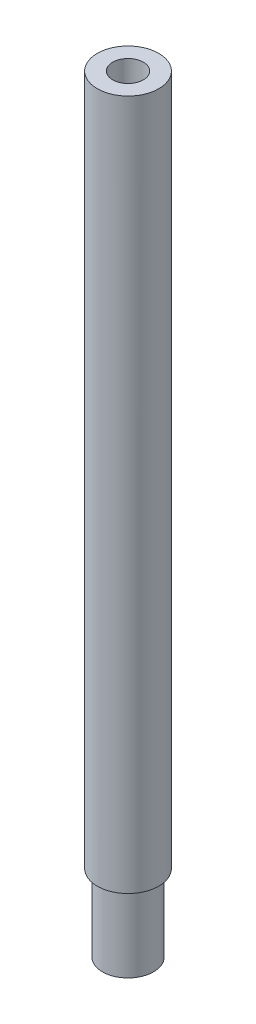
from build123d import *

# Parameters (mm, degrees)
SKETCH_1_R               = 6
EXTRUDE_2_DEPTH          = 150
CUT_EXTRUDE_2_DEPTH      = 151.239808307
CUT_EXTRUDE_2_DEPTH_BACK = 18
SKETCH_3_R               = 3
CUT_EXTRUDE_4_REACH      = 152.24
CUT_EXTRUDE_4_END_RADIUS = 6
SKETCH_4_R               = 1.25
SKETCH_5_R               = 6
SKETCH_5_R_2             = 5
CUT_EXTRUDE_5_DEPTH      = 15


with BuildPart() as part:
    # ｽｹｯﾁ1 → ﾎﾞｽ - 押し出し2 (new body)
    with BuildSketch(Plane(origin=(0, 0, 0), x_dir=(1, 0, 0), z_dir=(0, 1, 0))):
        with Locations(Location((0, 0, 0), (0, 0, 270))):
            Circle(SKETCH_1_R)
    extrude(amount=EXTRUDE_2_DEPTH)

    # ｽｹｯﾁ3 → ｶｯﾄ - 押し出し2 (cut, two sides: drawn at the far end of the back side and taken through both)
    with BuildSketch(Plane(origin=(0, 150, 0), x_dir=(1, 0, 0), z_dir=(0, 1, 0)).offset(-CUT_EXTRUDE_2_DEPTH_BACK)):
        with Locations(Location((0, 0, 0), (0, 0, 90))):
            Circle(SKETCH_3_R)
    extrude(amount=CUT_EXTRUDE_2_DEPTH + CUT_EXTRUDE_2_DEPTH_BACK, mode=Mode.SUBTRACT)

    # ｶｯﾄ - 押し出し4: up to this cylinder (the profile starts inside it)
    cut_extrude_4_end = Plane(origin=(0, 142, 0), z_dir=(0, -1, 0)) * Cylinder(CUT_EXTRUDE_4_END_RADIUS, 317.48, mode=Mode.PRIVATE)
    # ｽｹｯﾁ4 → ｶｯﾄ - 押し出し4 (cut, up to the surface)
    with BuildSketch(Plane.XY, mode=Mode.PRIVATE) as cut_extrude_4_sk1:
        with Locations((0, 142)):
            Circle(SKETCH_4_R)
    cut_extrude_4_tool1 = extrude(cut_extrude_4_sk1.sketch, amount=-CUT_EXTRUDE_4_REACH, mode=Mode.PRIVATE) & cut_extrude_4_end
    add(cut_extrude_4_tool1.solids().sort_by_distance((0, 142, 0))[0], mode=Mode.SUBTRACT)

    # ｽｹｯﾁ5 → ｶｯﾄ - 押し出し5 (cut)
    with BuildSketch(Plane.XZ):
        with Locations(Location((0, 0, 0), (0, 0, 270))):
            Circle(SKETCH_5_R)
        with Locations(Location((0, 0, 0), (0, 0, 270))):
            Circle(SKETCH_5_R_2, mode=Mode.SUBTRACT)
    extrude(amount=-CUT_EXTRUDE_5_DEPTH, mode=Mode.SUBTRACT)


solid = part.part
